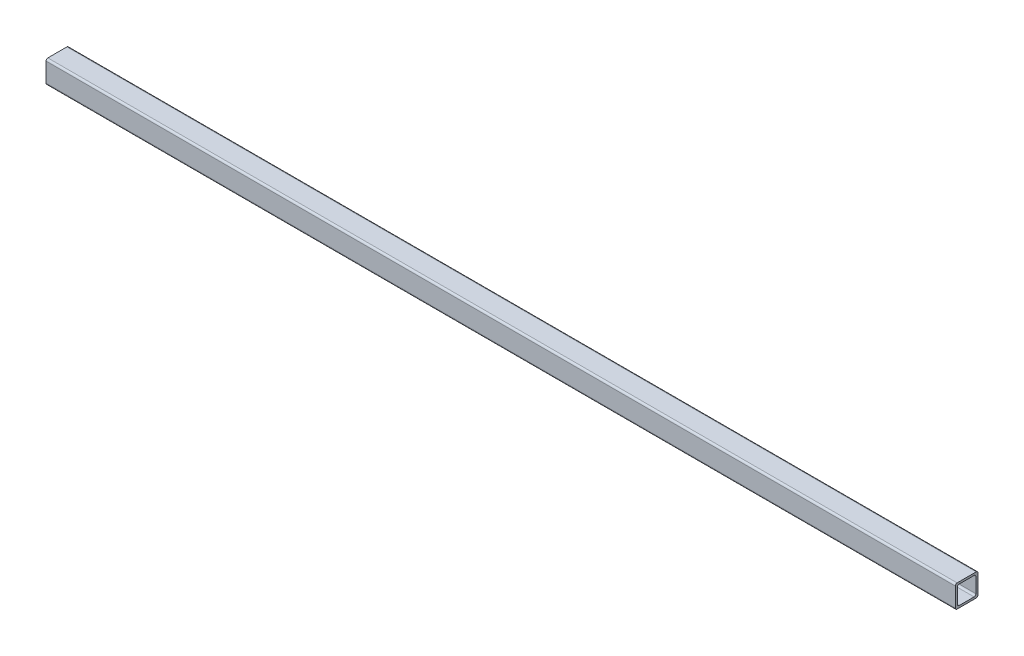
from build123d import *

# Parameters (mm, degrees)
SKETCH1_W               = 25
SKETCH1_H               = 25
BOSS_EXTRUDE1_DEPTH     = 500
FILLET1_R               = 2
CUT_EXTRUDE1_DEPTH      = 1001.390548736
CUT_EXTRUDE1_DEPTH_BACK = 1001.390548736
SKETCH2_W               = 20.4
SKETCH2_H               = 20.4
FILLET2_R               = 2


with BuildPart() as part:
    # Sketch1 → Boss-Extrude1 (new, symmetric)
    with BuildSketch(Plane(origin=(0, 0, 0), x_dir=(0, 0, -1), z_dir=(1, 0, 0))):
        with Locations((0, 12.5)):
            Rectangle(SKETCH1_W, SKETCH1_H)
    extrude(amount=BOSS_EXTRUDE1_DEPTH, both=True)

    # Fillet1
    fillet1_edges = [part.edges().sort_by_distance(p)[0] for p in [
        (0, 25, 12.5),
        (0, 25, -12.5),
        (0, 0, -12.5),
        (0, 0, 12.5),
    ]]
    fillet(fillet1_edges, radius=FILLET1_R)

    # Sketch2 → Cut-Extrude1 (cut, two sides: drawn at the far end of the back side and taken through both)
    with BuildSketch(Plane(origin=(500, 0, 0), x_dir=(0, 0, -1), z_dir=(1, 0, 0)).offset(-CUT_EXTRUDE1_DEPTH_BACK)):
        with Locations((0, 12.5)):
            Rectangle(SKETCH2_W, SKETCH2_H)
    extrude(amount=CUT_EXTRUDE1_DEPTH + CUT_EXTRUDE1_DEPTH_BACK, mode=Mode.SUBTRACT)

    # Fillet2
    fillet2_edges = [part.edges().sort_by_distance(p)[0] for p in [
        (0, 22.7, 10.2),
        (0, 22.7, -10.2),
        (0, 2.3, -10.2),
        (0, 2.3, 10.2),
    ]]
    fillet(fillet2_edges, radius=FILLET2_R)


solid = part.part
